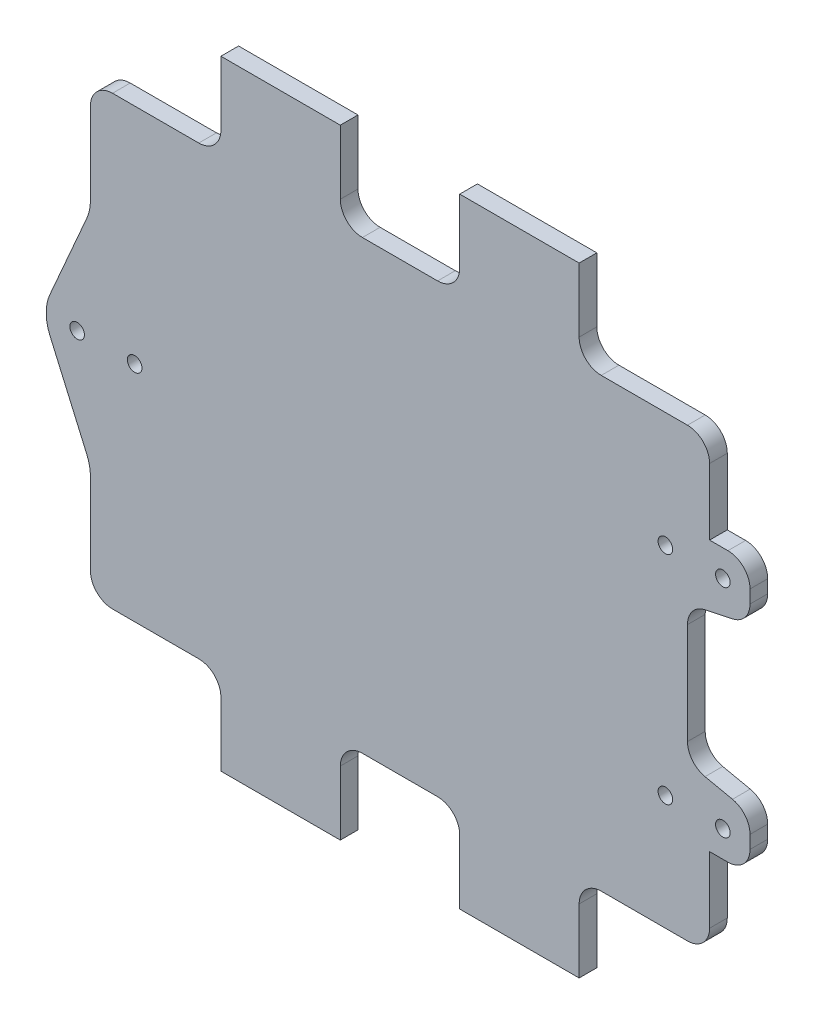
from build123d import *

# Parameters (mm, degrees)
BOSS_EXTRUDE1_DEPTH                             = 4
SKETCH3_W                                       = 29.5
SKETCH3_H                                       = 19.5
SKETCH3_W_2                                     = 27
CUT_EXTRUDE3_DEPTH                              = 195.527632999
BOSS_EXTRUDE2_DEPTH                             = 4
FILLET5_R                                       = 5
CSK_FOR_M3_FLAT_HEAD_MACHINE_SCREW1_D           = 3.3
CSK_FOR_M3_FLAT_HEAD_MACHINE_SCREW1_CSINK_D     = 6
CSK_FOR_M3_FLAT_HEAD_MACHINE_SCREW1_CSINK_ANGLE = 90
SKETCH8_R                                       = 1.65
CUT_EXTRUDE4_DEPTH                              = 205.595641739
FILLET6_R                                       = 5


with BuildPart() as part:
    # Sketch1 → Boss-Extrude1 (new body)
    with BuildSketch(Plane.XY):
        with BuildLine():
            Line((0, 0), (135, 0))
            Line((135, 0), (135, 140))
            Line((135, 140), (0, 140))
            Line((0, 140), (0, 97.072711728))
            ThreePointArc((0, 97.072711728), (-0.211219914, 95.028259617), (-0.835956887, 93.070173307))
            Line((-0.835956887, 93.070173307), (-9.164043113, 74.002538421))
            ThreePointArc((-9.164043113, 74.002538421), (-10, 70), (-9.164043113, 65.997461579))
            Line((-9.164043113, 65.997461579), (-0.835956887, 46.929826693))
            ThreePointArc((-0.835956887, 46.929826693), (-0.211219914, 44.971740383), (0, 42.927288272))
            Line((0, 42.927288272), (0, 0))
        make_face()
    extrude(amount=BOSS_EXTRUDE1_DEPTH)

    # Sketch3 → Cut-Extrude3 (cut, through all)
    with BuildSketch(Plane.XY.offset(4)):
        with Locations((14.75, 9.75)):
            Rectangle(SKETCH3_W, SKETCH3_H)
        with Locations((70, 9.75)):
            Rectangle(SKETCH3_W_2, SKETCH3_H)
        with Locations((125.25, 130.25)):
            Rectangle(SKETCH3_W, SKETCH3_H)
        with Locations((125.25, 9.75)):
            Rectangle(SKETCH3_W, SKETCH3_H)
        with Locations((14.75, 130.25)):
            Rectangle(SKETCH3_W, SKETCH3_H)
        with Locations((70, 130.25)):
            Rectangle(SKETCH3_W_2, SKETCH3_H)
    extrude(amount=-CUT_EXTRUDE3_DEPTH, mode=Mode.SUBTRACT)

    # Sketch9 → Boss-Extrude2 (add)
    with BuildSketch(Plane(origin=(0, 0, 0), x_dir=(-1, 0, 0), z_dir=(0, 0, -1))):
        Polygon((-140, 100.5), (-149.142135624, 100.5), (-149.142135624, 88.5), (-135, 85.5), (-135, 105.5), (-135, 120.5), (-140, 120.5), align=None)
        Polygon((-140, 19.5), (-140, 39.5), (-149.142135624, 39.5), (-149.142135624, 51.5), (-135, 54.5), (-135, 34.5), (-135, 19.5), align=None)
    extrude(amount=-BOSS_EXTRUDE2_DEPTH)

    # Fillet5
    fillet5_edges = [part.edges().sort_by_distance(p)[0] for p in [
        (135, 85.5, 2),
        (149.142135624, 88.5, 2),
        (149.142135624, 100.5, 2),
        (149.142135624, 39.5, 2),
        (149.142135624, 51.5, 2),
        (135, 54.5, 2),
    ]]
    fillet(fillet5_edges, radius=FILLET5_R)

    # CSK for M3 Flat Head Machine Screw1 (through all)
    with Locations(Plane(origin=(0, 0, 0), x_dir=(-1, 0, 0), z_dir=(0, 0, -1))):
        with Locations((-10, 70), (-130, 94.5), (-130, 45.5)):
            CounterSinkHole(CSK_FOR_M3_FLAT_HEAD_MACHINE_SCREW1_D / 2, CSK_FOR_M3_FLAT_HEAD_MACHINE_SCREW1_CSINK_D / 2, counter_sink_angle=CSK_FOR_M3_FLAT_HEAD_MACHINE_SCREW1_CSINK_ANGLE)

    # Sketch8 → Cut-Extrude4 (cut, through all)
    with BuildSketch(Plane(origin=(0, 0, 0), x_dir=(-1, 0, 0), z_dir=(0, 0, -1))):
        with Locations((3, 70)):
            Circle(SKETCH8_R)
        with Locations((-143, 94.5)):
            Circle(SKETCH8_R)
        with Locations((-143, 45.5)):
            Circle(SKETCH8_R)
    extrude(amount=-CUT_EXTRUDE4_DEPTH, mode=Mode.SUBTRACT)

    # Fillet6
    fillet6_edges = [part.edges().sort_by_distance(p)[0] for p in [
        (83.5, 120.5, 2),
        (56.5, 120.5, 2),
        (140, 120.5, 2),
        (140, 19.5, 2),
        (0, 19.5, 2),
        (29.5, 19.5, 2),
        (56.5, 19.5, 2),
        (83.5, 19.5, 2),
        (110.5, 19.5, 2),
        (110.5, 120.5, 2),
        (29.5, 120.5, 2),
        (0, 120.5, 2),
    ]]
    fillet(fillet6_edges, radius=FILLET6_R)


solid = part.part
